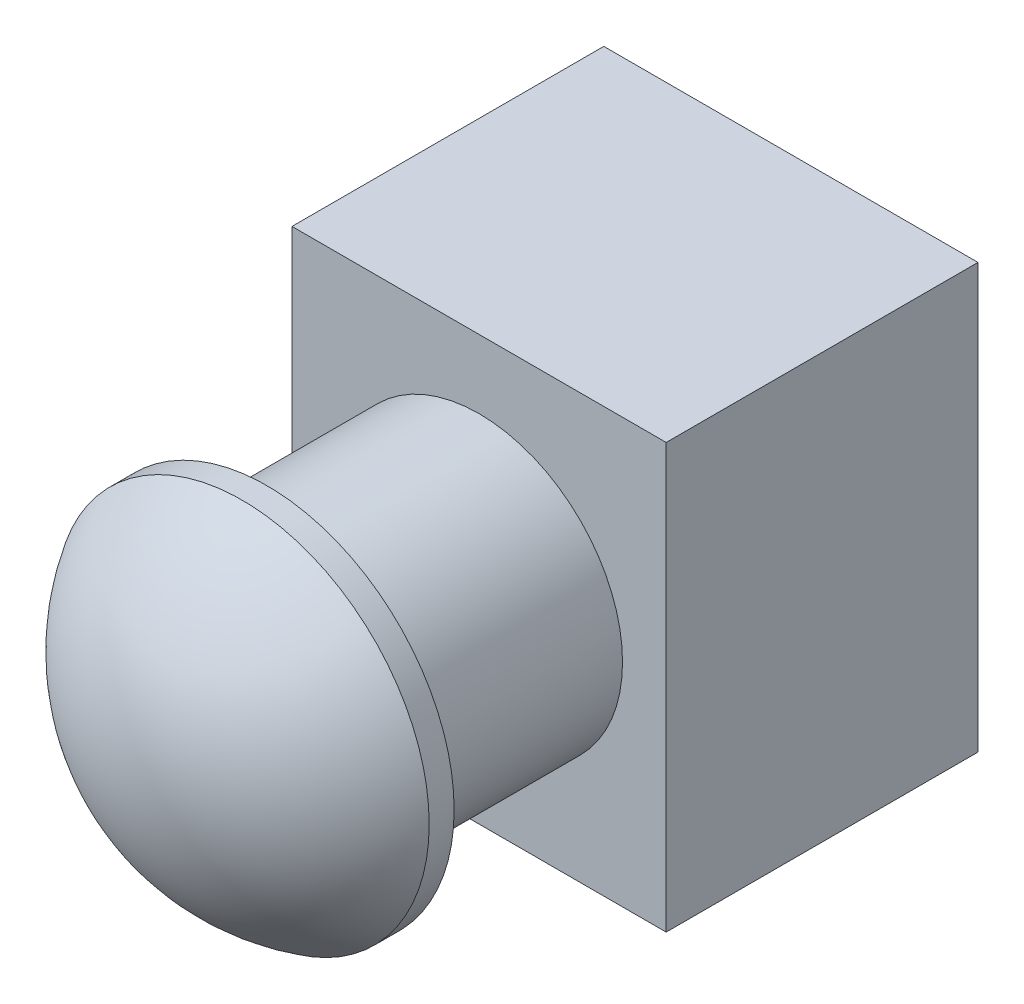
from build123d import *

# Parameters (mm, degrees)
SKETCH_1_W      = 30
SKETCH_1_H      = 34
EXTRUDE_1_DEPTH = 25
SKETCH_2_R      = 11.5
EXTRUDE_2_DEPTH = 17


with BuildPart() as part:
    # 草图1 → 凸台-拉伸1 (new body)
    with BuildSketch(Plane.XY):
        Rectangle(SKETCH_1_W, SKETCH_1_H)
    extrude(amount=EXTRUDE_1_DEPTH)

    # 草图2 → 凸台-拉伸2 (add)
    with BuildSketch(Plane.XY.offset(25)):
        Circle(SKETCH_2_R)
    extrude(amount=EXTRUDE_2_DEPTH)

    # 草图3 → 旋转1 (revolve)
    with BuildSketch(Plane(origin=(0, 0, 0), x_dir=(1, 0, 0), z_dir=(0, 1, 0))):
        with BuildLine():
            Line((0, -42), (15, -42))
            Line((15, -42), (15, -44))
            ThreePointArc((15, -44), (8.618709266, -50.222281386), (0, -52.492855685))
            Line((0, -52.492855685), (0, -42))
        make_face()
    revolve(axis=Axis((0, 0, 42), (0, 0, 1)))


solid = part.part
